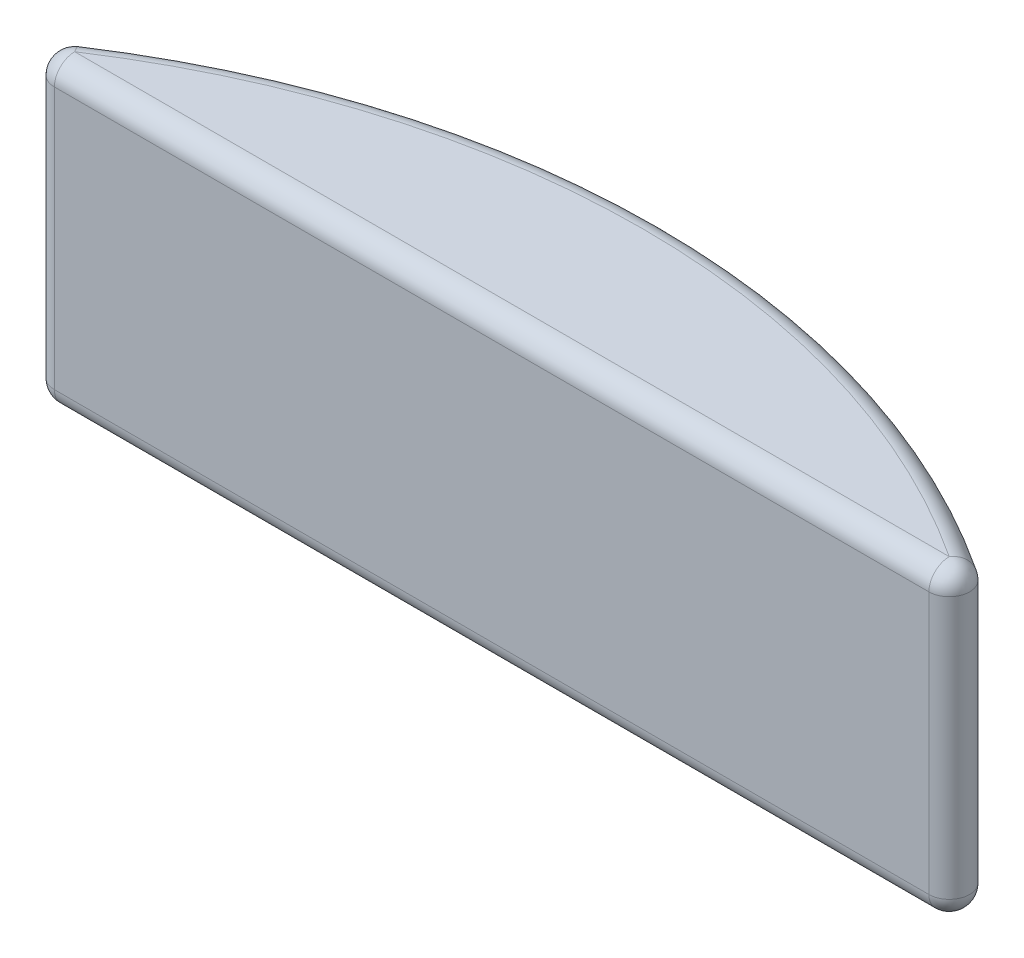
from build123d import *

# Parameters (mm, degrees)
BOSS_EXTRUDE1_DEPTH = 23.8252
FILLET1_R           = 1.6002


with BuildPart() as part:
    # Sketch1 → Boss-Extrude1 (new body)
    with BuildSketch(Plane(origin=(0, 0, 0), x_dir=(1, 0, 0), z_dir=(0, 1, 0))):
        with BuildLine():
            Line((-34.407907286, 50.8), (34.407907286, 50.8))
            ThreePointArc((34.407907286, 50.8), (35.941054018, 51.941832093), (35.286229068, 53.737806402))
            ThreePointArc((35.286229068, 53.737806402), (0, 64.2874), (-35.286229068, 53.737806402))
            ThreePointArc((-35.286229068, 53.737806402), (-35.941054018, 51.941832093), (-34.407907286, 50.8))
        make_face()
    extrude(amount=BOSS_EXTRUDE1_DEPTH)

    # Fillet1
    fillet1_edges = [part.edges().sort_by_distance(p)[0] for p in [
        (-35.941054018, 23.8252, -51.941832093),
        (0, 23.8252, -50.8),
        (35.941054018, 23.8252, -51.941832093),
        (0, 0, -50.8),
        (-35.941054018, 0, -51.941832093),
        (0, 0, -64.2874),
        (35.941054018, 0, -51.941832093),
        (0, 23.8252, -64.2874),
    ]]
    fillet(fillet1_edges, radius=FILLET1_R)


solid = part.part
